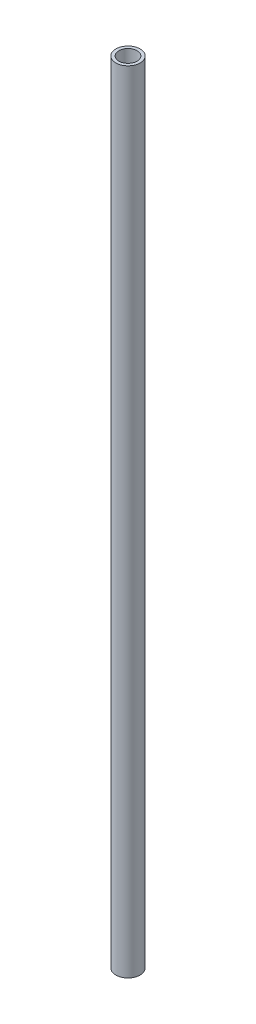
from build123d import *

# Parameters (mm, degrees)
SKETCH_1_R      = 4
SKETCH_1_R_2    = 3
EXTRUDE_1_DEPTH = 130


with BuildPart() as part:
    # 草图1 → 凸台-拉伸1 (new, symmetric)
    with BuildSketch(Plane(origin=(0, 0, 0), x_dir=(1, 0, 0), z_dir=(0, 1, 0))):
        with Locations(Location((0, 0, 0), (0, 0, 270))):
            Circle(SKETCH_1_R)
        with Locations(Location((0, 0, 0), (0, 0, 270))):
            Circle(SKETCH_1_R_2, mode=Mode.SUBTRACT)
    extrude(amount=EXTRUDE_1_DEPTH, both=True)


solid = part.part
